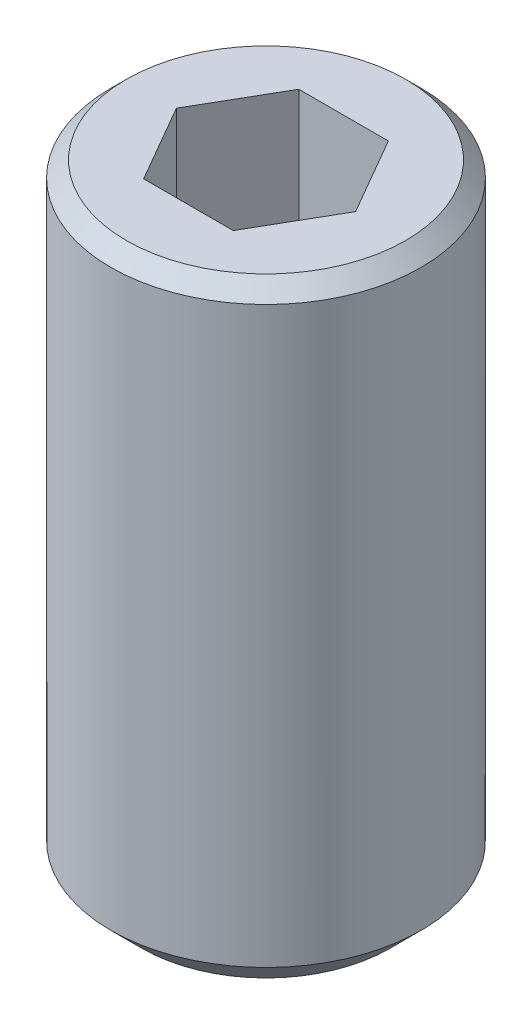
from build123d import *

# Parameters (mm, degrees)
CROQUIS1_W            = 1.5
CROQUIS1_H            = 6
CORTAR_EXTRUIR2_DEPTH = 1.5
CHAFL_N3_SIZE         = 0.3
CHAFL_N4_SIZE         = 0.15


with BuildPart() as part:
    # Croquis1 → Revolución1 (revolve)
    with BuildSketch(Plane.XY, mode=Mode.PRIVATE) as revoluci_n1_sk:
        with Locations((0.75, -3)):
            Rectangle(CROQUIS1_W, CROQUIS1_H)
    revolve(revoluci_n1_sk.sketch.rotate(Axis((0, 0, 0), (0, -1, 0)), 90), axis=Axis((0, 0, 0), (0, -1, 0)))

    # Croquis3 → Cortar-Extruir2 (cut)
    with BuildSketch(Plane(origin=(0, 0, 0), x_dir=(1, 0, 0), z_dir=(0, 1, 0))):
        Polygon((-0.433012702, 0.75), (-0.866025404, 0), (-0.433012702, -0.75), (0.433012702, -0.75), (0.866025404, 0), (0.433012702, 0.75), align=None)
    extrude(amount=-CORTAR_EXTRUIR2_DEPTH, mode=Mode.SUBTRACT)

    # Chaflán3
    chafl_n3_edges = [part.edges().sort_by_distance(p)[0] for p in [
        (0, -6, -1.5),
    ]]
    chamfer(chafl_n3_edges, length=CHAFL_N3_SIZE)

    # Chaflán4
    chafl_n4_edges = [part.edges().sort_by_distance(p)[0] for p in [
        (0, 0, -1.5),
    ]]
    chamfer(chafl_n4_edges, length=CHAFL_N4_SIZE)


solid = part.part
